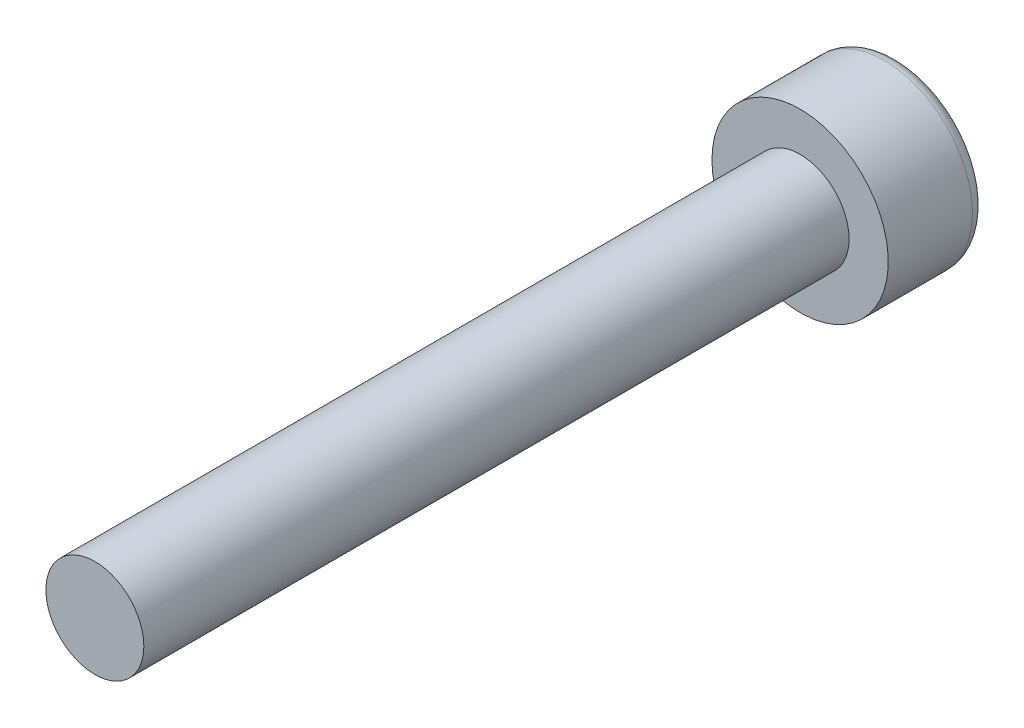
from build123d import *

# Parameters (mm, degrees)
CROQUIS1_R              = 1.25
SALIENTE_EXTRUIR1_DEPTH = 18
CROQUIS2_R              = 2.25
SALIENTE_EXTRUIR2_DEPTH = 2.5
CORTAR_EXTRUIR1_DEPTH   = 1.5
REDONDEO1_R             = 0.35


with BuildPart() as part:
    # Croquis1 → Saliente-Extruir1 (new body)
    with BuildSketch(Plane.XY):
        Circle(CROQUIS1_R)
    extrude(amount=SALIENTE_EXTRUIR1_DEPTH)

    # Croquis2 → Saliente-Extruir2 (add)
    with BuildSketch(Plane(origin=(0, 0, 0), x_dir=(-1, 0, 0), z_dir=(0, 0, -1))):
        Circle(CROQUIS2_R)
    extrude(amount=SALIENTE_EXTRUIR2_DEPTH)

    # Croquis3 → Cortar-Extruir1 (cut)
    with BuildSketch(Plane(origin=(0, 0, -2.5), x_dir=(-1, 0, 0), z_dir=(0, 0, -1))):
        Polygon((0, -1.154700538), (1, -0.577350269), (1, 0.577350269), (0, 1.154700538), (-1, 0.577350269), (-1, -0.577350269), align=None)
    extrude(amount=-CORTAR_EXTRUIR1_DEPTH, mode=Mode.SUBTRACT)

    # Redondeo1
    redondeo1_edges = [part.edges().sort_by_distance(p)[0] for p in [
        (2.25, 0, -2.5),
    ]]
    fillet(redondeo1_edges, radius=REDONDEO1_R)


solid = part.part
